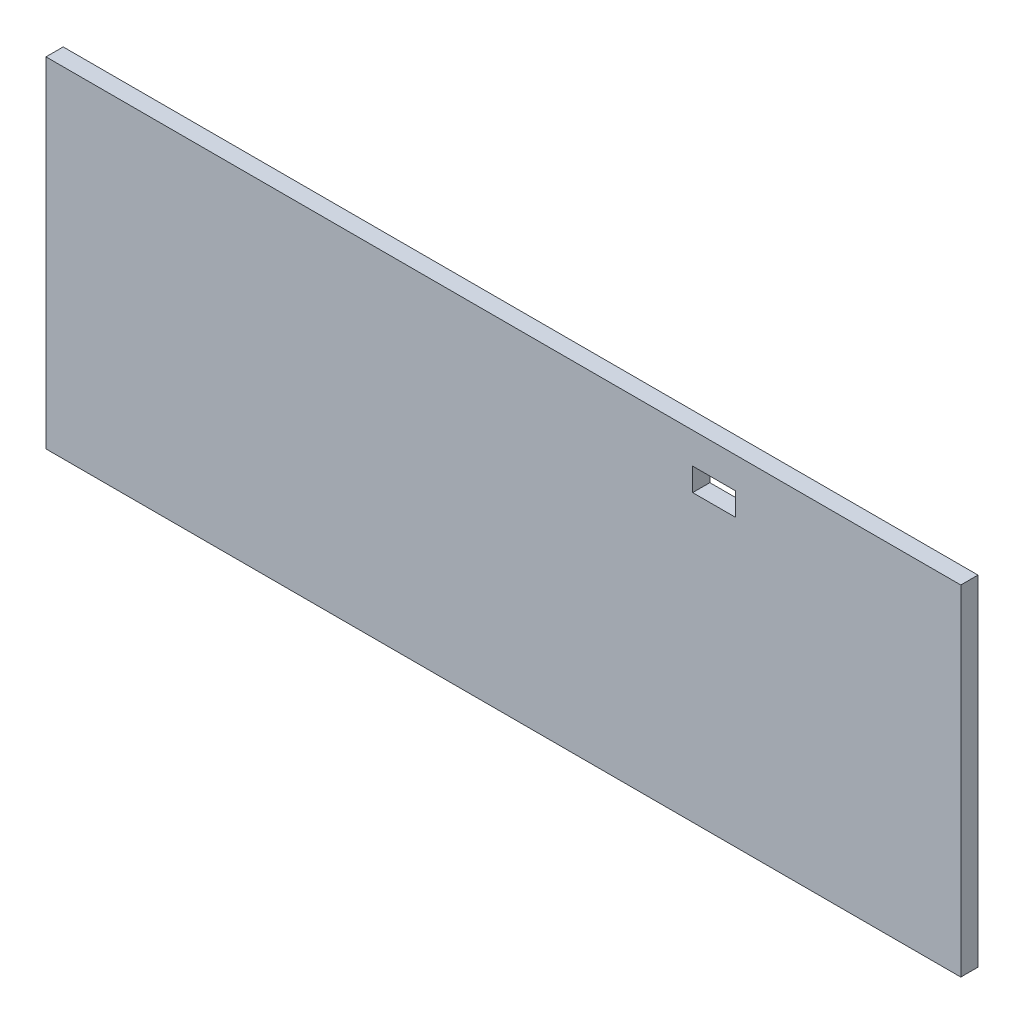
from build123d import *

# Parameters (mm, degrees)
ESQUISSE1_W             = 319
ESQUISSE1_H             = 118.414906094
BOSS_EXTRU_1_DEPTH      = 6
ENL_V_MAT_EXTRU_1_REACH = 334.629
ESQUISSE2_W             = 15
ESQUISSE2_H             = 8


with BuildPart() as part:
    # Esquisse1 → Boss.-Extru.1 (new body)
    with BuildSketch(Plane.XY):
        with Locations((153.5, -53.207453047)):
            Rectangle(ESQUISSE1_W, ESQUISSE1_H)
    extrude(amount=BOSS_EXTRU_1_DEPTH)

    # Esquisse2 → Enlèv. mat.-Extru.1 (cut, up to next)
    with BuildSketch(Plane(origin=(0, 0, 0), x_dir=(-1, 0, 0), z_dir=(0, 0, -1)), mode=Mode.PRIVATE) as enl_v_mat_extru_1_sk1:
        with Locations((-227, -8.85)):
            Rectangle(ESQUISSE2_W, ESQUISSE2_H)
    enl_v_mat_extru_1_tool1 = extrude(enl_v_mat_extru_1_sk1.sketch, amount=-ENL_V_MAT_EXTRU_1_REACH, mode=Mode.PRIVATE) & part.part
    add(enl_v_mat_extru_1_tool1.solids().sort_by_distance((227, -8.85, 0))[0], mode=Mode.SUBTRACT)


solid = part.part
